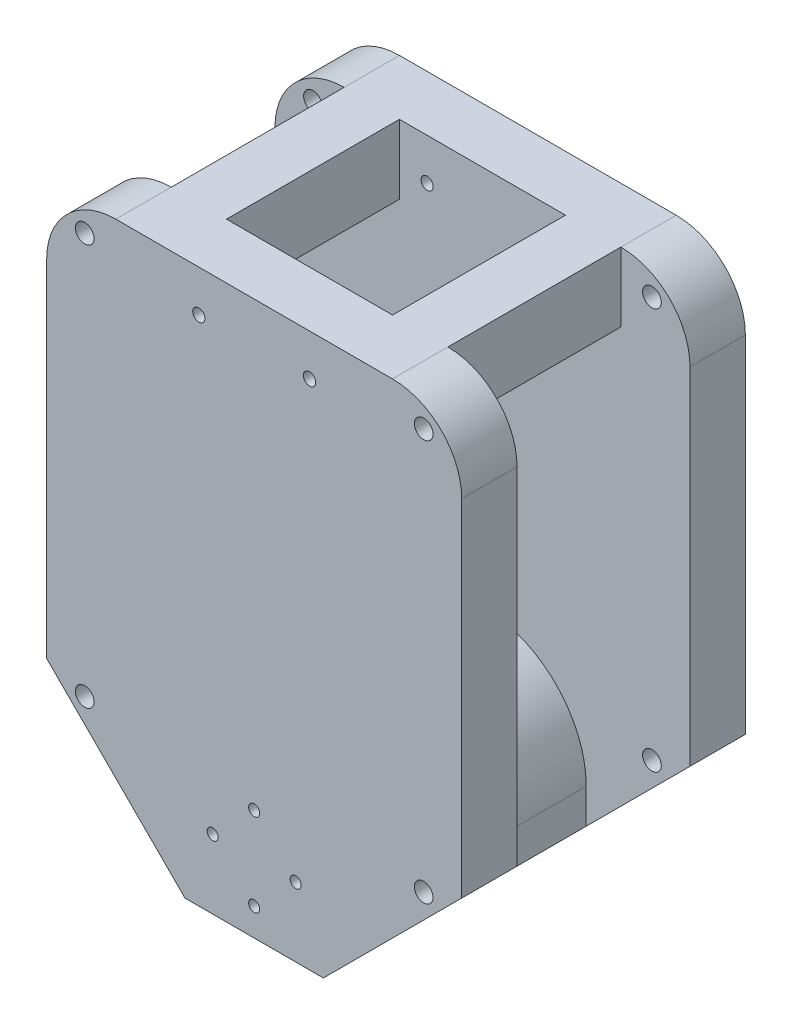
from build123d import *

# Parameters (mm, degrees)
SKETCH1_R           = 0.883567379
SKETCH1_R_2         = 0.896609669
SKETCH1_R_3         = 0.8
SKETCH1_R_4         = 1.35
BOSS_EXTRUDE1_DEPTH = 8
SKETCH2_W           = 8
SKETCH2_H           = 10
BOSS_EXTRUDE3_DEPTH = 25
BOSS_EXTRUDE4_START = 33
SKETCH1_2_R         = 0.883567379
SKETCH1_2_R_2       = 0.896609669
SKETCH1_2_R_3       = 0.8
SKETCH1_2_R_4       = 1.35
BOSS_EXTRUDE4_DEPTH = 8
CUT_EXTRUDE1_DEPTH  = 3
CUT_EXTRUDE2_START  = 28
CUT_EXTRUDE2_DEPTH  = 3
BOSS_EXTRUDE5_DEPTH = 25
CUT_EXTRUDE3_DEPTH  = 41
FILLET5_R           = 10


with BuildPart() as part:
    # Sketch1 → Boss-Extrude1 (new body)
    with BuildSketch(Plane.XY):
        Polygon((-30, 20.206387144), (0, 20.206387144), (30, 20.206387144), (30, -59.793612856), (-30, -59.793612856), align=None)
        with Locations((-8, 14.206387144)):
            Circle(SKETCH1_R, mode=Mode.SUBTRACT)
        with Locations((8, 14.206387144)):
            Circle(SKETCH1_R_2, mode=Mode.SUBTRACT)
        with Locations((0, -43.793612856)):
            Circle(SKETCH1_R_3, mode=Mode.SUBTRACT)
        with Locations((6, -49.793612856)):
            Circle(SKETCH1_R_3, mode=Mode.SUBTRACT)
        with Locations((0, -55.793612856)):
            Circle(SKETCH1_R_3, mode=Mode.SUBTRACT)
        with Locations((-6, -49.793612856)):
            Circle(SKETCH1_R_3, mode=Mode.SUBTRACT)
        with Locations((-24.5, 16.206387144)):
            Circle(SKETCH1_R_4, mode=Mode.SUBTRACT)
        with Locations((24.5, 16.206387144)):
            Circle(SKETCH1_R_4, mode=Mode.SUBTRACT)
        with Locations((-24.5, -41.793612856)):
            Circle(SKETCH1_R_4, mode=Mode.SUBTRACT)
        with Locations((24.5, -41.793612856)):
            Circle(SKETCH1_R_4, mode=Mode.SUBTRACT)
    extrude(amount=BOSS_EXTRUDE1_DEPTH)

    # Sketch2 → Boss-Extrude3 (add)
    with BuildSketch(Plane.XY.offset(8)):
        with Locations((-16, 15.206387144)):
            Rectangle(SKETCH2_W, SKETCH2_H)
        with Locations((16, 15.206387144)):
            Rectangle(SKETCH2_W, SKETCH2_H)
    extrude(amount=BOSS_EXTRUDE3_DEPTH)

    # Sketch1<2> → Boss-Extrude4 (add)
    with BuildSketch(Plane.XY.offset(BOSS_EXTRUDE4_START)):
        Polygon((-30, 20.206387144), (0, 20.206387144), (30, 20.206387144), (30, -59.793612856), (-30, -59.793612856), align=None)
        with Locations((-8, 14.206387144)):
            Circle(SKETCH1_2_R, mode=Mode.SUBTRACT)
        with Locations((8, 14.206387144)):
            Circle(SKETCH1_2_R_2, mode=Mode.SUBTRACT)
        with Locations((0, -43.793612856)):
            Circle(SKETCH1_2_R_3, mode=Mode.SUBTRACT)
        with Locations((6, -49.793612856)):
            Circle(SKETCH1_2_R_3, mode=Mode.SUBTRACT)
        with Locations((0, -55.793612856)):
            Circle(SKETCH1_2_R_3, mode=Mode.SUBTRACT)
        with Locations((-6, -49.793612856)):
            Circle(SKETCH1_2_R_3, mode=Mode.SUBTRACT)
        with Locations((-24.5, 16.206387144)):
            Circle(SKETCH1_2_R_4, mode=Mode.SUBTRACT)
        with Locations((24.5, 16.206387144)):
            Circle(SKETCH1_2_R_4, mode=Mode.SUBTRACT)
        with Locations((-24.5, -41.793612856)):
            Circle(SKETCH1_2_R_4, mode=Mode.SUBTRACT)
        with Locations((24.5, -41.793612856)):
            Circle(SKETCH1_2_R_4, mode=Mode.SUBTRACT)
    extrude(amount=BOSS_EXTRUDE4_DEPTH)

    # Sketch3 → Cut-Extrude1 (cut)
    with BuildSketch(Plane.XY.offset(8)):
        with BuildLine():
            Line((-10, -49.793612856), (-10, -59.793612856))
            Line((-10, -59.793612856), (10, -59.793612856))
            Line((10, -59.793612856), (10, -49.793612856))
            ThreePointArc((10, -49.793612856), (0, -39.793612856), (-10, -49.793612856))
        make_face()
    extrude(amount=-CUT_EXTRUDE1_DEPTH, mode=Mode.SUBTRACT)

    # Sketch3<2> → Cut-Extrude2 (cut)
    with BuildSketch(Plane.XY.offset(8).offset(CUT_EXTRUDE2_START)):
        with BuildLine():
            Line((-10, -49.793612856), (-10, -59.793612856))
            Line((-10, -59.793612856), (10, -59.793612856))
            Line((10, -59.793612856), (10, -49.793612856))
            ThreePointArc((10, -49.793612856), (0, -39.793612856), (-10, -49.793612856))
        make_face()
    extrude(amount=-CUT_EXTRUDE2_DEPTH, mode=Mode.SUBTRACT)

    # Sketch5 → Boss-Extrude5 (add)
    with BuildSketch(Plane(origin=(0, 0, 33), x_dir=(-1, 0, 0), z_dir=(0, 0, -1))):
        with BuildLine():
            Line((-15, -49.793612856), (-15, -59.793612856))
            Line((-15, -59.793612856), (-10, -59.793612856))
            Line((-10, -59.793612856), (-10, -49.793612856))
            ThreePointArc((-10, -49.793612856), (0, -39.793612856), (10, -49.793612856))
            Line((10, -49.793612856), (10, -59.793612856))
            Line((10, -59.793612856), (15, -59.793612856))
            Line((15, -59.793612856), (15, -49.793612856))
            ThreePointArc((15, -49.793612856), (0, -34.793612856), (-15, -49.793612856))
        make_face()
    extrude(amount=BOSS_EXTRUDE5_DEPTH)

    # Sketch7 → Cut-Extrude3 (cut)
    with BuildSketch(Plane.XY.offset(41)):
        Polygon((30, -39.793612856), (30, -59.793612856), (10, -59.793612856), align=None)
        Polygon((-30, -39.793612856), (-30, -59.793612856), (-10, -59.793612856), align=None)
    extrude(amount=-CUT_EXTRUDE3_DEPTH, mode=Mode.SUBTRACT)

    # Fillet5
    fillet5_edges = [part.edges().sort_by_distance(p)[0] for p in [
        (-30, 20.206387144, 37),
        (-30, 20.206387144, 4),
        (30, 20.206387144, 4),
        (30, 20.206387144, 37),
    ]]
    fillet(fillet5_edges, radius=FILLET5_R)


solid = part.part
